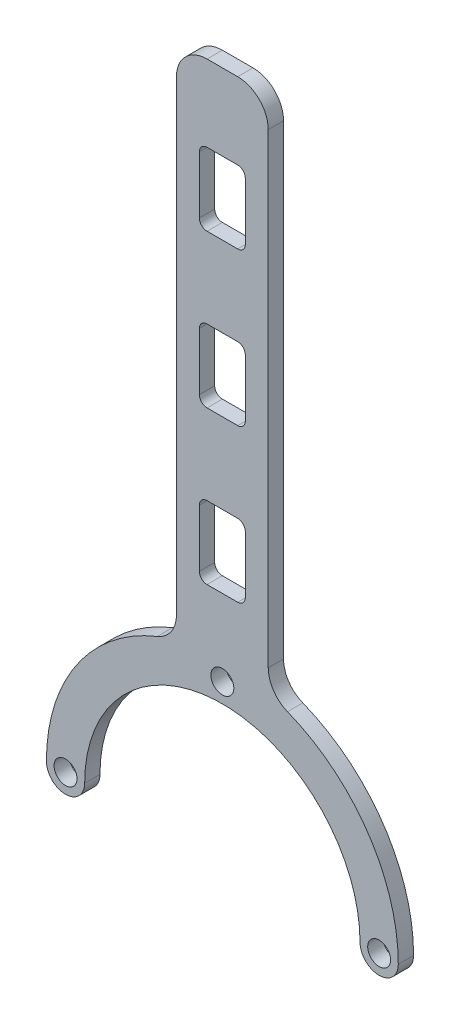
from build123d import *

# Parameters (mm, degrees)
SKETCH_1_W      = 6
SKETCH_1_H      = 9.5
SKETCH_1_R      = 1.5
EXTRUDE_1_DEPTH = 2
FILLET_1_R      = 1
FILLET_2_R      = 4


with BuildPart() as part:
    # 草图1 → 凸台-拉伸1 (new body)
    with BuildSketch(Plane.XY):
        with BuildLine():
            Line((6, 22.203603311), (6, 90))
            Line((6, 90), (-6, 90))
            Line((-6, 90), (-6, 22.203603311))
            ThreePointArc((-6, 22.203603311), (-18.261982368, 13.982131454), (-23, 0))
            ThreePointArc((-23, 0), (-20.5, -2.5), (-18, 0))
            ThreePointArc((-18, 0), (0, 18), (18, 0))
            ThreePointArc((18, 0), (20.5, -2.5), (23, 0))
            ThreePointArc((23, 0), (18.261982368, 13.982131454), (6, 22.203603311))
        make_face()
        with Locations((0, 35.25)):
            Rectangle(SKETCH_1_W, SKETCH_1_H, mode=Mode.SUBTRACT)
        with Locations((0, 55.25)):
            Rectangle(SKETCH_1_W, SKETCH_1_H, mode=Mode.SUBTRACT)
        with Locations((0, 75.25)):
            Rectangle(SKETCH_1_W, SKETCH_1_H, mode=Mode.SUBTRACT)
        with Locations((0, 20.5)):
            Circle(SKETCH_1_R, mode=Mode.SUBTRACT)
        with Locations((20.5, 0)):
            Circle(SKETCH_1_R, mode=Mode.SUBTRACT)
        with Locations((-20.5, 0)):
            Circle(SKETCH_1_R, mode=Mode.SUBTRACT)
    extrude(amount=EXTRUDE_1_DEPTH)

    # 圆角1
    fillet_1_edges = [part.edges().sort_by_distance(p)[0] for p in [
        (3, 30.5, 1),
        (3, 40, 1),
        (-3, 40, 1),
        (-3, 30.5, 1),
        (3, 50.5, 1),
        (3, 60, 1),
        (-3, 60, 1),
        (-3, 50.5, 1),
        (-3, 80, 1),
        (-3, 70.5, 1),
        (3, 70.5, 1),
        (3, 80, 1),
    ]]
    fillet(fillet_1_edges, radius=FILLET_1_R)

    # 圆角2
    fillet_2_edges = [part.edges().sort_by_distance(p)[0] for p in [
        (-6, 22.203603311, 1),
        (-6, 90, 1),
        (6, 90, 1),
        (6, 22.203603311, 1),
    ]]
    fillet(fillet_2_edges, radius=FILLET_2_R)


solid = part.part
